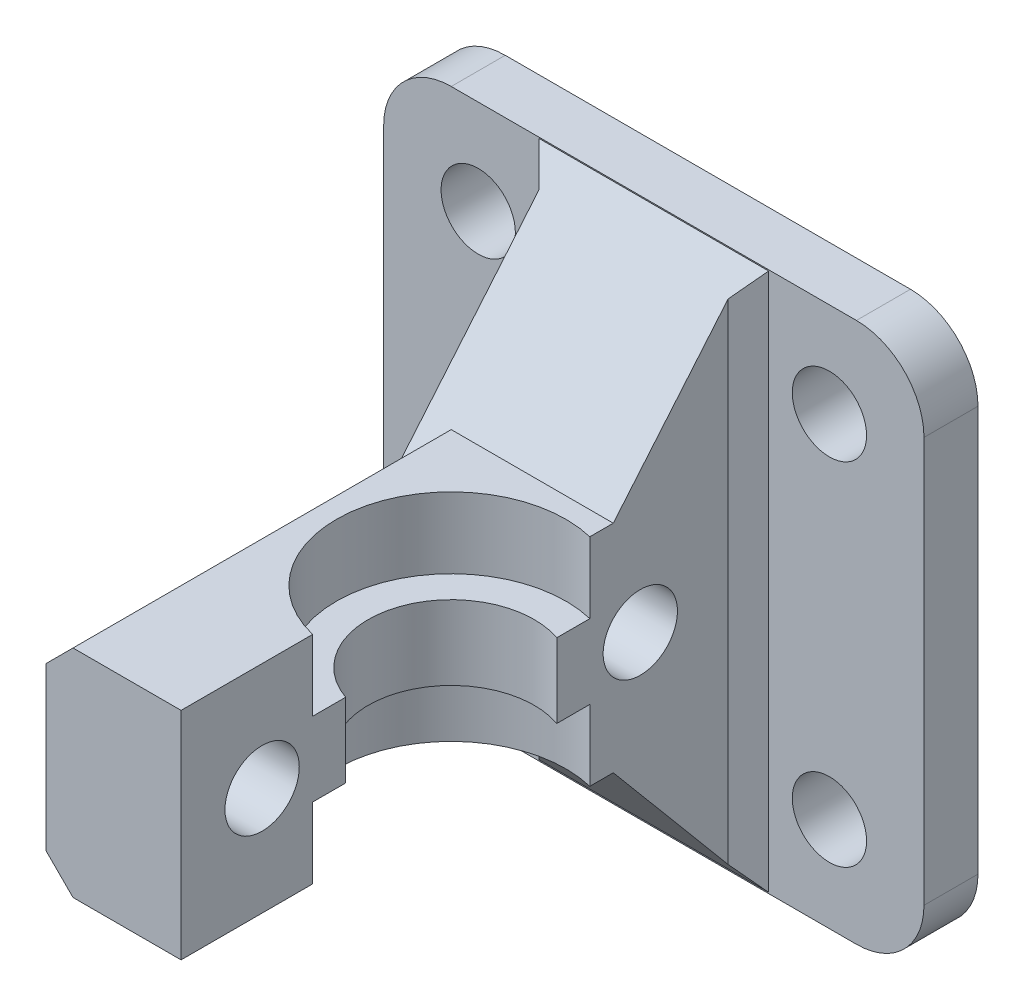
from build123d import *
from OCP.BRepFilletAPI import BRepFilletAPI_MakeChamfer

# Parameters (mm, degrees)
SKETCH1_W           = 40
SKETCH1_H           = 40
BOSS_EXTRUDE1_DEPTH = 4
CUT_EXTRUDE1_REACH  = 30.566
SKETCH2_R           = 2.75
BOSS_EXTRUDE2_DEPTH = 8
CHAMFER1_SIZE       = 10
CHAMFER1_SIZE2      = 11.917535926
SKETCH4_R           = 2.75
CUT_EXTRUDE2_DEPTH  = 7
BOSS_EXTRUDE3_DEPTH = 2.75
CHAMFER2_SIZE       = 1.5
FILLET1_R           = 5
CHAMFER3_SIZE       = 2


with BuildPart() as part:
    # Sketch1 → Boss-Extrude1 (new body)
    with BuildSketch(Plane.XY):
        Rectangle(SKETCH1_W, SKETCH1_H)
    extrude(amount=BOSS_EXTRUDE1_DEPTH)

    # Sketch2 → Cut-Extrude1 (cut, up to next)
    with BuildSketch(Plane.XY, mode=Mode.PRIVATE) as cut_extrude1_sk1:
        with Locations((-13, 13)):
            Circle(SKETCH2_R)
    cut_extrude1_tool1 = extrude(cut_extrude1_sk1.sketch, amount=CUT_EXTRUDE1_REACH, mode=Mode.PRIVATE) & part.part
    # Sketch2 → Cut-Extrude1 (cut, up to next)
    with BuildSketch(Plane.XY, mode=Mode.PRIVATE) as cut_extrude1_sk2:
        with Locations(Location((13, 13, 0), (0, 0, 180))):
            Circle(SKETCH2_R)
    cut_extrude1_tool2 = extrude(cut_extrude1_sk2.sketch, amount=CUT_EXTRUDE1_REACH, mode=Mode.PRIVATE) & part.part
    # Sketch2 → Cut-Extrude1 (cut, up to next)
    with BuildSketch(Plane.XY, mode=Mode.PRIVATE) as cut_extrude1_sk3:
        with Locations((13, -13)):
            Circle(SKETCH2_R)
    cut_extrude1_tool3 = extrude(cut_extrude1_sk3.sketch, amount=CUT_EXTRUDE1_REACH, mode=Mode.PRIVATE) & part.part
    # Sketch2 → Cut-Extrude1 (cut, up to next)
    with BuildSketch(Plane.XY, mode=Mode.PRIVATE) as cut_extrude1_sk4:
        with Locations(Location((-13, -13, 0), (0, 0, 180))):
            Circle(SKETCH2_R)
    cut_extrude1_tool4 = extrude(cut_extrude1_sk4.sketch, amount=CUT_EXTRUDE1_REACH, mode=Mode.PRIVATE) & part.part
    add(cut_extrude1_tool1.solids().sort_by_distance((-13, 13, 0))[0], mode=Mode.SUBTRACT)
    add(cut_extrude1_tool2.solids().sort_by_distance((13, 13, 0))[0], mode=Mode.SUBTRACT)
    add(cut_extrude1_tool3.solids().sort_by_distance((13, -13, 0))[0], mode=Mode.SUBTRACT)
    add(cut_extrude1_tool4.solids().sort_by_distance((-13, -13, 0))[0], mode=Mode.SUBTRACT)

    # Sketch3 → Boss-Extrude2 (add, symmetric)
    with BuildSketch(Plane(origin=(0, 0, 0), x_dir=(1, 0, 0), z_dir=(0, 1, 0))):
        with BuildLine():
            Line((-7, -4), (-7, -42))
            Line((-7, -42), (3, -42))
            Line((3, -42), (3, -32.261355821))
            ThreePointArc((3, -32.261355821), (-3.261355821, -22), (7, -15.738644179))
            Line((7, -15.738644179), (7, -4))
            Line((7, -4), (-7, -4))
        make_face()
    extrude(amount=BOSS_EXTRUDE2_DEPTH, both=True)

    # Chamfer1: one chamfer whose edges measure the first distance from different faces: ONE call of the kernel's chamfer builder (chamfer() names one face for all edges)
    chamfer1_edges_1 = [part.edges().sort_by_distance(p)[0] for p in [
        (0, -8, 4),
    ]]
    chamfer1_side_1 = [part.faces().sort_by_distance(p)[0] for p in [
        (6.595030865, -8, 9.86932209),
    ]]
    chamfer1_edges_2 = [part.edges().sort_by_distance(p)[0] for p in [
        (0, 8, 4),
    ]]
    chamfer1_side_2 = [part.faces().sort_by_distance(p)[0] for p in [
        (6.595030865, 8, 9.86932209),
    ]]
    chamfer1 = BRepFilletAPI_MakeChamfer(part.part.solid().wrapped)
    for e in chamfer1_edges_1:
        chamfer1.Add(CHAMFER1_SIZE, CHAMFER1_SIZE2, e.wrapped, chamfer1_side_1[0].wrapped)  # the first distance lies on this face
    for e in chamfer1_edges_2:
        chamfer1.Add(CHAMFER1_SIZE, CHAMFER1_SIZE2, e.wrapped, chamfer1_side_2[0].wrapped)  # the first distance lies on this face
    add(Compound.cast(chamfer1.Shape()), mode=Mode.REPLACE)

    # Sketch4 → Cut-Extrude2 (cut, symmetric)
    with BuildSketch(Plane(origin=(0, 0, 0), x_dir=(0, 0, -1), z_dir=(1, 0, 0))):
        with Locations((-12, 0)):
            Circle(SKETCH4_R)
        with Locations((-36, 0)):
            Circle(SKETCH4_R)
    extrude(amount=CUT_EXTRUDE2_DEPTH, both=True, mode=Mode.SUBTRACT)

    # Sketch5 → Boss-Extrude3 (add, symmetric)
    with BuildSketch(Plane(origin=(0, 0, 0), x_dir=(1, 0, 0), z_dir=(0, 1, 0))):
        with BuildLine():
            Line((7, -15.738644179), (7, -18.184288522))
            ThreePointArc((7, -18.184288522), (-0.815711478, -22), (3, -29.815711478))
            Line((3, -29.815711478), (3, -32.261355821))
            ThreePointArc((3, -32.261355821), (-3.261355821, -22), (7, -15.738644179))
        make_face()
    extrude(amount=BOSS_EXTRUDE3_DEPTH, both=True)

    # Chamfer2
    chamfer2_edges = [part.edges().sort_by_distance(p)[0] for p in [
        (7, 0, 4),
        (-7, 0, 4),
    ]]
    chamfer(chamfer2_edges, length=CHAMFER2_SIZE)

    # Fillet1
    fillet1_edges = [part.edges().sort_by_distance(p)[0] for p in [
        (20, -20, 2),
        (-20, -20, 2),
        (-20, 20, 2),
        (20, 20, 2),
    ]]
    fillet(fillet1_edges, radius=FILLET1_R)

    # Chamfer3
    chamfer3_edges = [part.edges().sort_by_distance(p)[0] for p in [
        (-7, -8, 28),
        (-7, 8, 28),
    ]]
    chamfer(chamfer3_edges, length=CHAMFER3_SIZE)


solid = part.part
